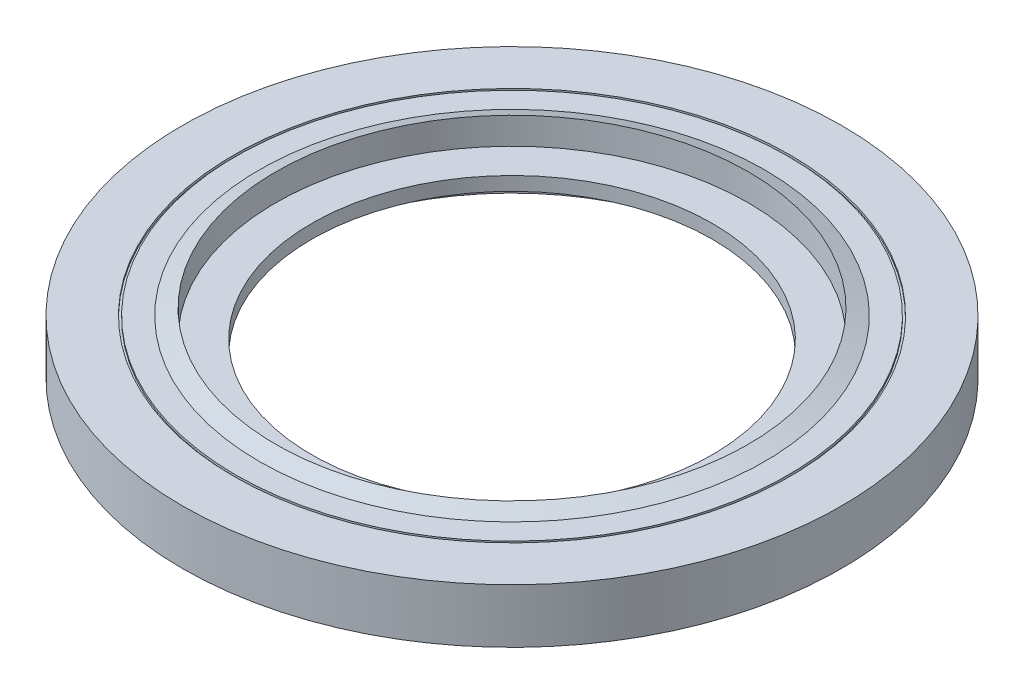
from build123d import *


with BuildPart() as part:
    # Sketch1 → Revolve1 (revolve)
    with BuildSketch(Plane.XY):
        Polygon((9.12, -0.3125), (9.12, 0.3125), (10.75, 0.3125), (10.75, 1.535), (11.5, 1.235), (12.566666667, 1.235), (12.566666667, 1.135), (12.666666667, 1.135), (12.666666667, 1.235), (15, 1.235), (15, -1.235), (12.666666667, -1.235), (12.666666667, -1.135), (12.566666667, -1.135), (12.566666667, -1.235), (11.5, -1.235), (10.75, -1.535), (10.75, -0.3125), align=None)
    revolve(axis=Axis((0, 0, 0), (0, 1, 0)))


solid = part.part
